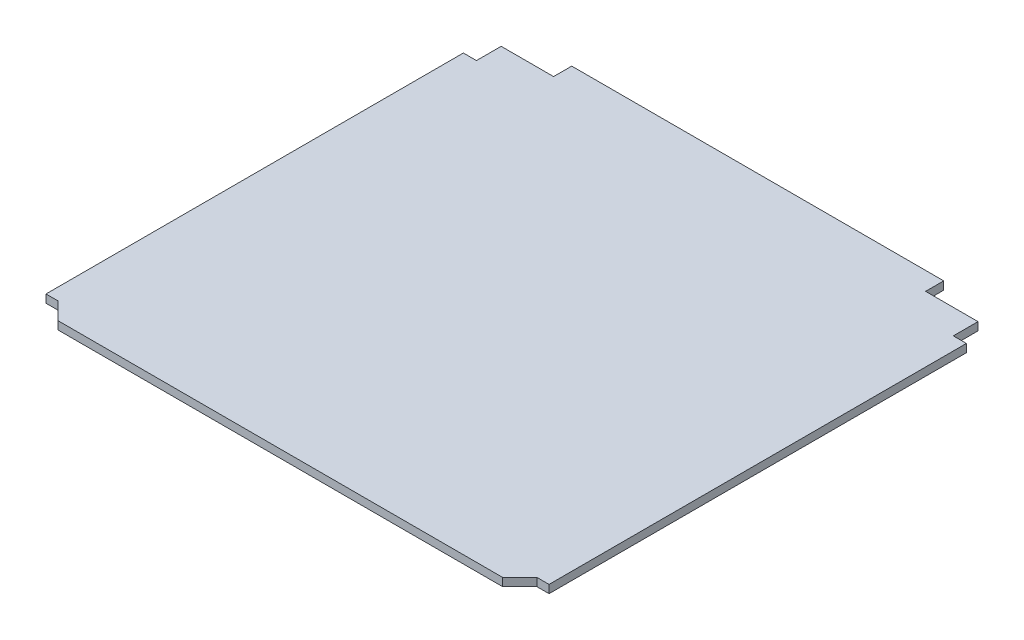
from build123d import *

# Parameters (mm, degrees)
BOSS_EXTRUDE1_DEPTH     = 0.8
ADDTOLERANCE_DEPTH      = 71.715203457
ADDTOLERANCE_DEPTH_BACK = 71.715203457
CUT_EXTRUDE1_DEPTH      = 71.573791169
CUT_EXTRUDE1_DEPTH_BACK = 71.573791169


with BuildPart() as part:
    # Sketch2 → Boss-Extrude1 (new, symmetric)
    with BuildSketch(Plane(origin=(0, 0, 0), x_dir=(1, 0, 0), z_dir=(0, 1, 0))):
        Polygon((41.5, -47.4), (47.4, -41.5), (50, -41.5), (50, 41.5), (47.4, 41.5), (47.4, 46.4), (37, 46.4), (37, 50), (-37, 50), (-37, 46.4), (-47.4, 46.4), (-47.4, 41.5), (-50, 41.5), (-50, -41.5), (-47.4, -41.5), (-41.5, -47.4), align=None)
    extrude(amount=BOSS_EXTRUDE1_DEPTH, both=True)

    # Sketch3 → AddTolerance (cut, two sides: drawn at the far end of the back side and taken through both)
    with BuildSketch(Plane(origin=(0, 0, 0), x_dir=(1, 0, 0), z_dir=(0, 1, 0)).offset(-ADDTOLERANCE_DEPTH_BACK)):
        Polygon((37, 50), (-37, 50), (-37, 46.4), (-47.4, 46.4), (-47.4, 41.5), (-50, 41.5), (-50, -41.5), (-47.4, -41.5), (-47.5, -41.4), (-49.9, -41.4), (-49.9, 41.4), (-47.3, 41.4), (-47.3, 46.3), (-36.9, 46.3), (-36.9, 49.9), (36.9, 49.9), (36.9, 46.3), (47.3, 46.3), (47.3, 41.4), (49.9, 41.4), (49.9, -41.4), (47.5, -41.4), (47.4, -41.5), (50, -41.5), (50, 41.5), (47.4, 41.5), (47.4, 46.4), (37, 46.4), align=None)
    extrude(amount=ADDTOLERANCE_DEPTH + ADDTOLERANCE_DEPTH_BACK, mode=Mode.SUBTRACT)

    # Sketch4 → Cut-Extrude1 (cut, two sides: drawn at the far end of the back side and taken through both)
    with BuildSketch(Plane(origin=(0, 0, 0), x_dir=(1, 0, 0), z_dir=(0, 1, 0)).offset(-CUT_EXTRUDE1_DEPTH_BACK)):
        Polygon((-41.5, -47.4), (41.5, -47.4), (43.1, -45.8), (-43.1, -45.8), align=None)
        Polygon((-43.1, -45.8), (43.1, -45.8), (44.1, -44.8), (-44.1, -44.8), align=None)
    extrude(amount=CUT_EXTRUDE1_DEPTH + CUT_EXTRUDE1_DEPTH_BACK, mode=Mode.SUBTRACT)


solid = part.part
